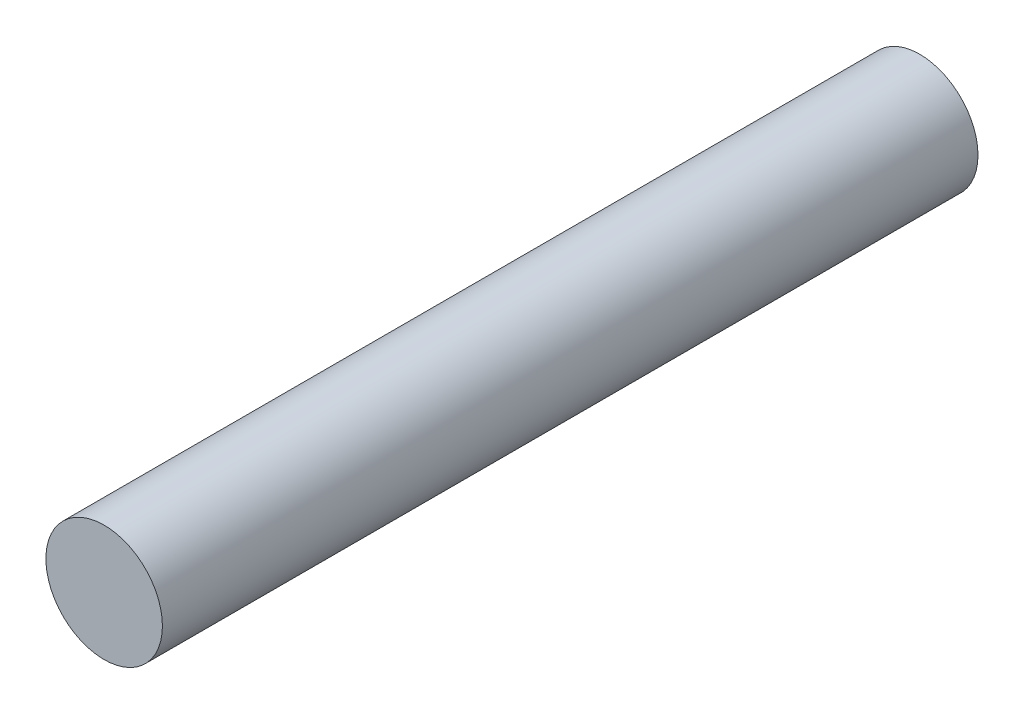
from build123d import *

# Parameters (mm, degrees)
SKETCH1_R           = 2
BOSS_EXTRUDE1_DEPTH = 28


with BuildPart() as part:
    # Sketch1 → Boss-Extrude1 (new body)
    with BuildSketch(Plane.XY):
        Circle(SKETCH1_R)
    extrude(amount=BOSS_EXTRUDE1_DEPTH)


solid = part.part
